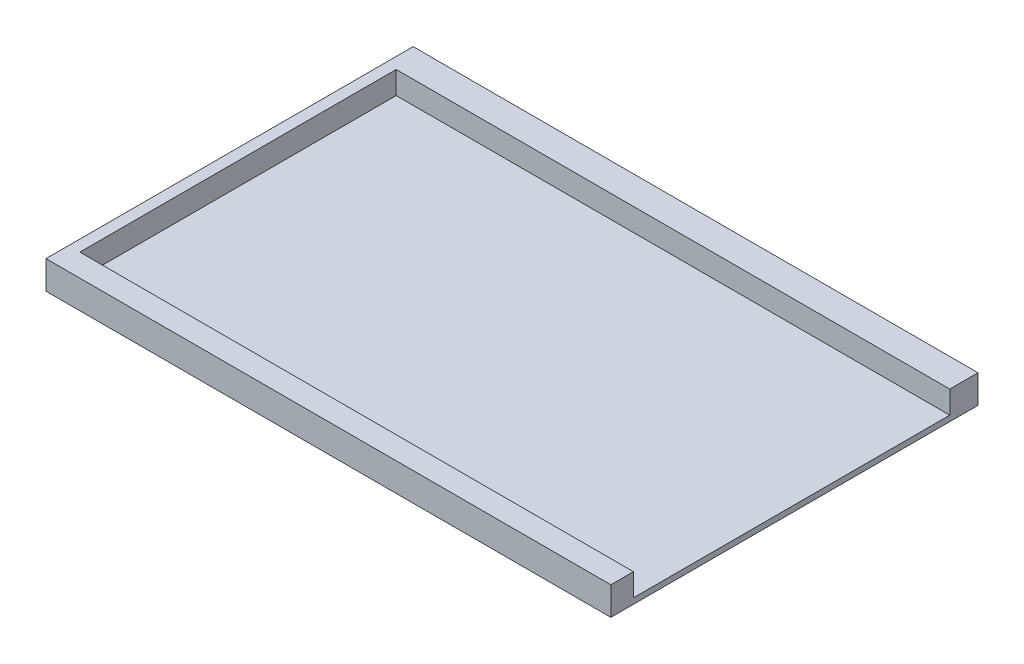
from build123d import *

# Parameters (mm, degrees)
SKETCH3_W           = 100
SKETCH3_H           = 65
BOSS_EXTRUDE2_DEPTH = 5
SKETCH5_W           = 56
SKETCH5_H           = 4
CUT_EXTRUDE1_DEPTH  = 98


with BuildPart() as part:
    # Sketch3 → Boss-Extrude2 (new body)
    with BuildSketch(Plane(origin=(0, 0, 0), x_dir=(1, 0, 0), z_dir=(0, 1, 0))):
        Rectangle(SKETCH3_W, SKETCH3_H)
    extrude(amount=BOSS_EXTRUDE2_DEPTH)

    # Sketch5 → Cut-Extrude1 (cut)
    with BuildSketch(Plane(origin=(50, 0, 0), x_dir=(0, 0, -1), z_dir=(1, 0, 0))):
        with Locations((-0.5, 3)):
            Rectangle(SKETCH5_W, SKETCH5_H)
    extrude(amount=-CUT_EXTRUDE1_DEPTH, mode=Mode.SUBTRACT)


solid = part.part
